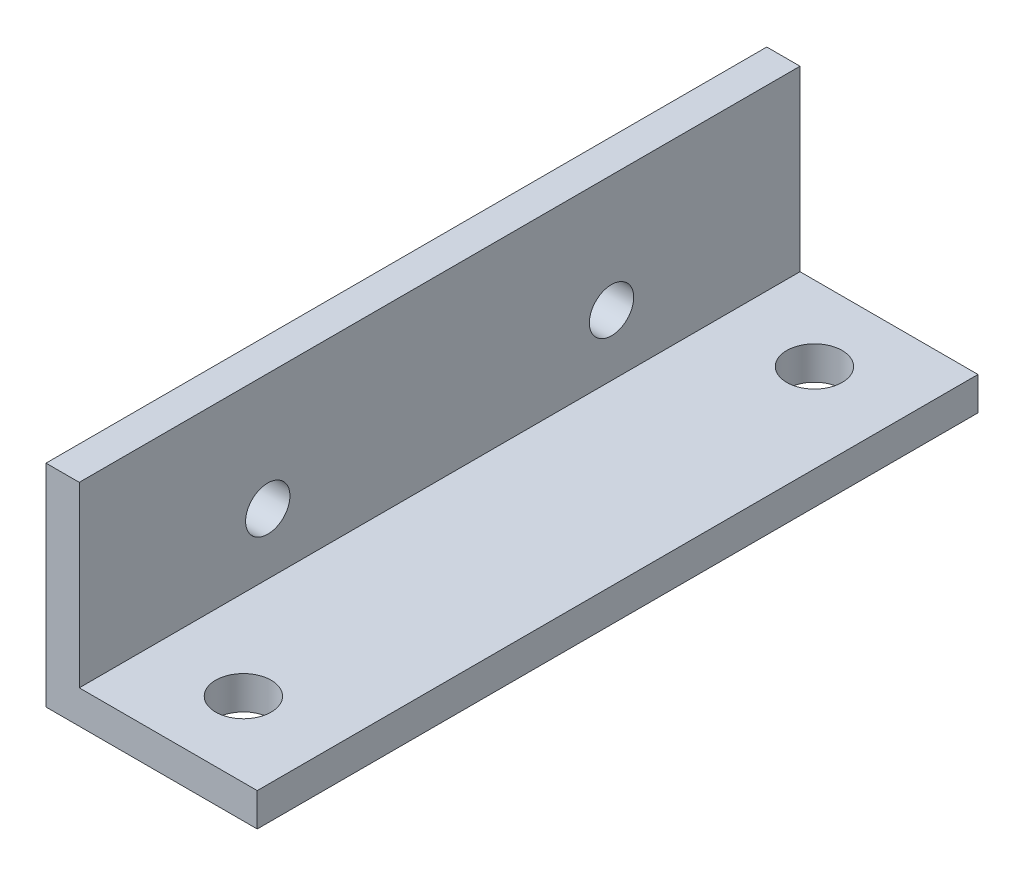
from build123d import *

# Parameters (mm, degrees)
EXTRUDE_THIN1_DEPTH = 32.5
CUT_EXTRUDE2_REACH  = 44.214
SKETCH4_R           = 2
SKETCH3_R           = 2.5
CUT_EXTRUDE1_DEPTH  = 3


with BuildPart() as part:
    # Sketch1 → Extrude-Thin1 (new, symmetric)
    with BuildSketch(Plane.XY):
        Polygon((19.05, 0), (0, 0), (0, 19.05), (3, 19.05), (3, 3), (19.05, 3), align=None)
    extrude(amount=EXTRUDE_THIN1_DEPTH, both=True)

    # Sketch4 → Cut-Extrude2 (cut, up to next)
    with BuildSketch(Plane.ZY, mode=Mode.PRIVATE) as cut_extrude2_sk1:
        with Locations((-15.5, 8.5)):
            Circle(SKETCH4_R)
    cut_extrude2_tool1 = extrude(cut_extrude2_sk1.sketch, amount=-CUT_EXTRUDE2_REACH, mode=Mode.PRIVATE) & part.part
    # Sketch4 → Cut-Extrude2 (cut, up to next)
    with BuildSketch(Plane.ZY, mode=Mode.PRIVATE) as cut_extrude2_sk2:
        with Locations((15.5, 8.5)):
            Circle(SKETCH4_R)
    cut_extrude2_tool2 = extrude(cut_extrude2_sk2.sketch, amount=-CUT_EXTRUDE2_REACH, mode=Mode.PRIVATE) & part.part
    add(cut_extrude2_tool1.solids().sort_by_distance((0, 8.5, -15.5))[0], mode=Mode.SUBTRACT)
    add(cut_extrude2_tool2.solids().sort_by_distance((0, 8.5, 15.5))[0], mode=Mode.SUBTRACT)

    # Sketch3 → Cut-Extrude1 (cut)
    with BuildSketch(Plane.XZ):
        with Locations(Location((11.05, -25.75, 0), (0, 0, 270))):
            Circle(SKETCH3_R)
        with Locations(Location((11.05, 25.75, 0), (0, 0, 270))):
            Circle(SKETCH3_R)
    extrude(amount=-CUT_EXTRUDE1_DEPTH, mode=Mode.SUBTRACT)


solid = part.part
